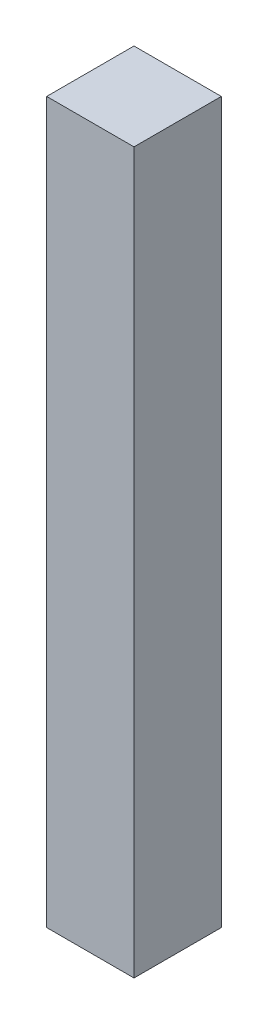
from build123d import *

# Parameters (mm, degrees)
SKETCH1_W           = 20
SKETCH1_H           = 20
BOSS_EXTRUDE1_DEPTH = 164.829187741


with BuildPart() as part:
    # Sketch1 → Boss-Extrude1 (new body)
    with BuildSketch(Plane(origin=(0, 0, 0), x_dir=(1, 0, 0), z_dir=(0, 1, 0))):
        with Locations((10, -10)):
            Rectangle(SKETCH1_W, SKETCH1_H)
    extrude(amount=BOSS_EXTRUDE1_DEPTH)


solid = part.part
